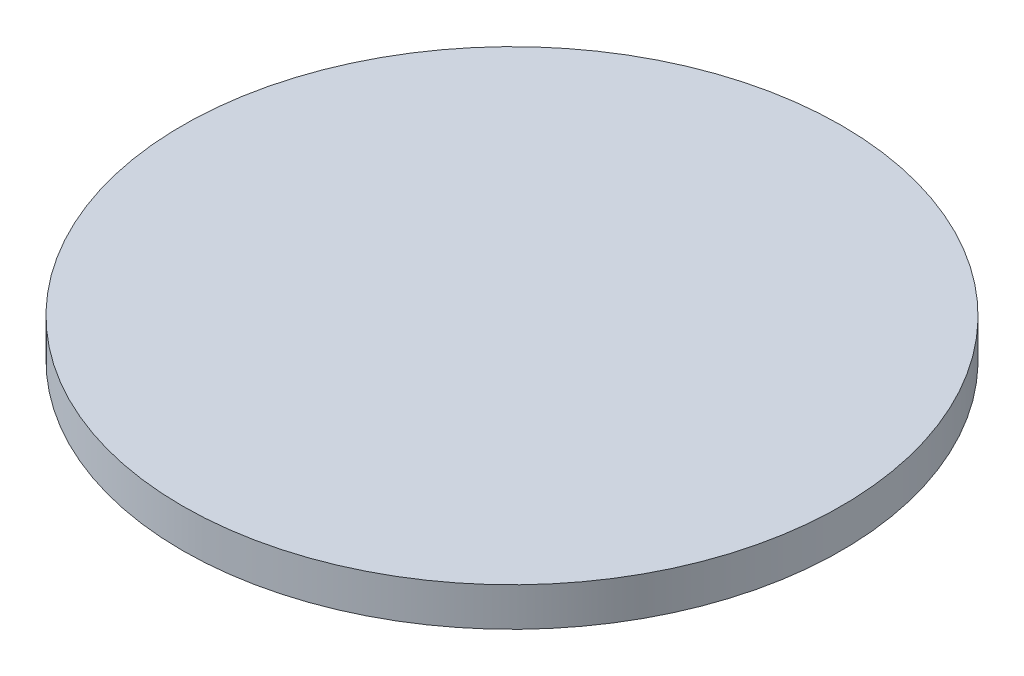
from build123d import *

# Parameters (mm, degrees)
SKETCH1_R           = 8.54
BOSS_EXTRUDE1_DEPTH = 1


with BuildPart() as part:
    # Sketch1 → Boss-Extrude1 (new body)
    with BuildSketch(Plane(origin=(0, 0, 0), x_dir=(1, 0, 0), z_dir=(0, 1, 0))):
        with Locations(Location((0, 0, 0), (0, 0, 270))):
            Circle(SKETCH1_R)
    extrude(amount=BOSS_EXTRUDE1_DEPTH)


solid = part.part
